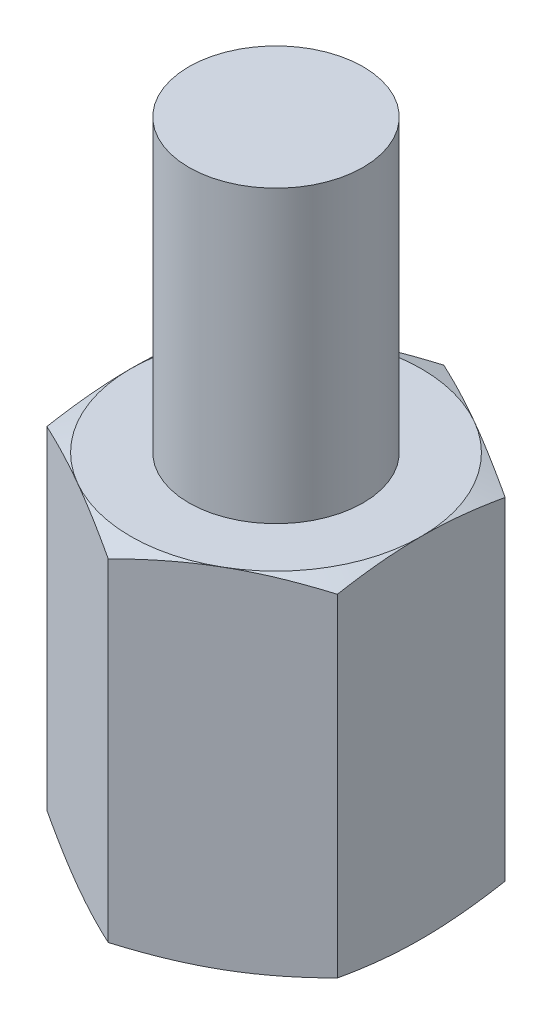
from build123d import *

# Parameters (mm, degrees)
SKETCH1_R                = 1.5
BOSS_EXTRUDE1_DEPTH      = 6
BOSS_EXTRUDE2_DEPTH      = 5
BOSS_EXTRUDE2_DEPTH_BACK = 1.5
SKETCH7_R                = 1.5


with BuildPart() as part:
    # Sketch1 → Boss-Extrude1 (new body)
    with BuildSketch(Plane(origin=(0, 0, 0), x_dir=(1, 0, 0), z_dir=(0, 1, 0))):
        Polygon((0, 2.886751346), (-2.5, 1.443375673), (-2.5, -1.443375673), (0, -2.886751346), (2.5, -1.443375673), (2.5, 1.443375673), align=None)
        with Locations(Location((0, 0, 0), (0, 0, 270))):
            Circle(SKETCH1_R, mode=Mode.SUBTRACT)
    extrude(amount=BOSS_EXTRUDE1_DEPTH)

    # Sketch6 → Cut-Revolve1 (revolve, cut)
    with BuildSketch(Plane.ZY):
        Polygon((2.5, 6), (2.886751346, 6), (2.886751346, 5.859234022), align=None)
    cut_revolve1 = revolve(axis=Axis((0, 6, 0), (0, 1, 0)), mode=Mode.SUBTRACT)

    # Mirror1: Cut-Revolve1 across plane
    add(cut_revolve1.mirror(Plane.ZX.offset(3)), mode=Mode.SUBTRACT)

    # Sketch7 → Boss-Extrude2 (add, two sides: drawn at the far end of the back side and taken through both)
    with BuildSketch(Plane(origin=(0, 6, 0), x_dir=(1, 0, 0), z_dir=(0, 1, 0)).offset(-BOSS_EXTRUDE2_DEPTH_BACK)):
        with Locations(Location((0, 0, 0), (0, 0, 270))):
            Circle(SKETCH7_R)
    extrude(amount=BOSS_EXTRUDE2_DEPTH + BOSS_EXTRUDE2_DEPTH_BACK)


solid = part.part
